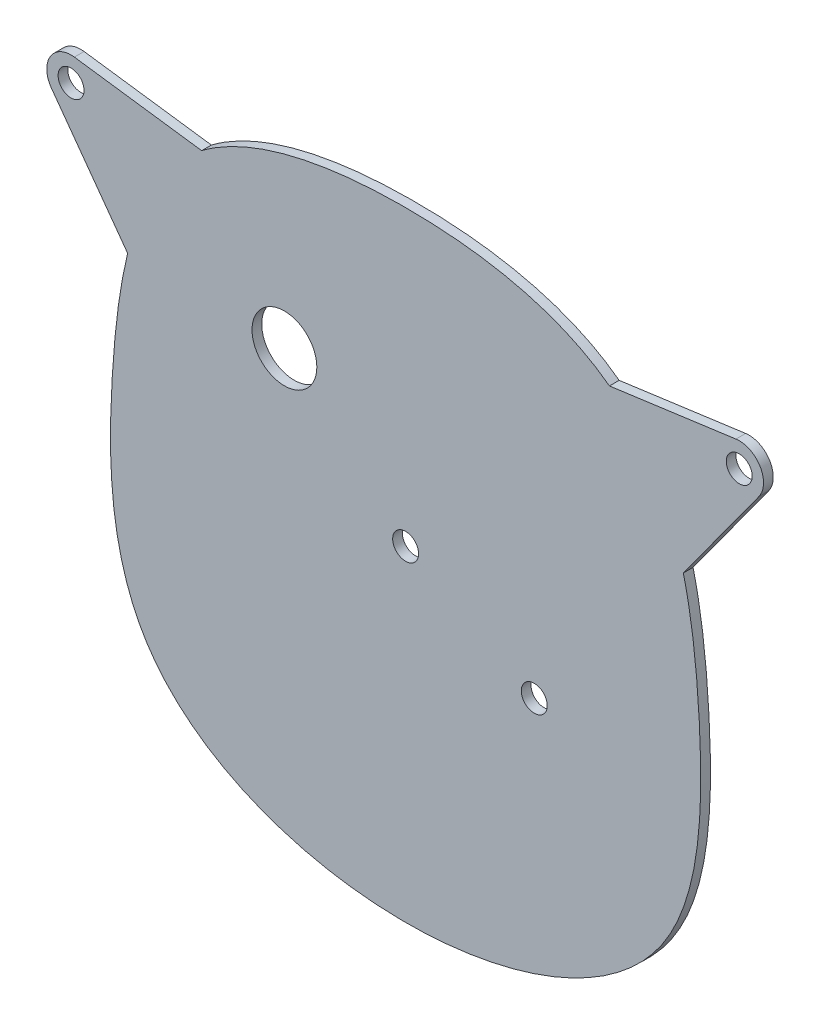
from build123d import *

# Parameters (mm, degrees)
SKETCH_2_R      = 4
SKETCH_2_R_2    = 4.000000012
SKETCH_2_R_3    = 10
EXTRUDE_2_DEPTH = 3


with BuildPart() as part:
    # 草图2 → 凸台-拉伸2 (new body)
    with BuildSketch(Plane.XY):
        with BuildLine():
            Line((-62.921735182, 74.245798648), (-102.190957478, 79.606919068))
            ThreePointArc((-102.190957478, 79.606919068), (-109.642306337, 76.02514292), (-109.271978796, 67.765931231))
            Line((-109.271978796, 67.765931231), (-85.74852731, 35.405842289))
            add(Edge.make_bspline(
                [(85.673591965, 35.711161483), (85.776981576, 35.292234587), (87.38306318, 28.632974431), (89.007173167, 18.400976728), (90.213980049, 5.05235491), (91.023425479, -8.300155004), (91.249087203, -24.88029803), (89.482806545, -40.668877417), (86.31440773, -52.443657906), (82.915098619, -60.73865793), (78.31847455, -68.385420626), (70.564310171, -77.478782389), (58.291973958, -86.77831017), (40.530617706, -94.699883912), (20.766532671, -99.44381146), (8e-09, -101.028094273), (-20.766532656, -99.44381146), (-40.530617691, -94.699883912), (-58.291973943, -86.77831017), (-70.564310156, -77.478782389), (-78.318474535, -68.385420626), (-82.915098604, -60.73865793), (-86.314407715, -52.443657906), (-89.48280653, -40.668877417), (-91.249087188, -24.88029803), (-91.023425464, -8.300155004), (-90.213980034, 5.05235491), (-89.007173152, 18.400976728), (-87.400005421, 28.526237122), (-85.826069563, 35.088143132), (-85.74852731, 35.405842289)],
                knots=[1.185395253, 1.185395253, 1.185395253, 1.185395253, 1.1875, 1.21875, 1.234375, 1.25, 1.28125, 1.3125, 1.328125, 1.34375, 1.359375, 1.375, 1.40625, 1.4375, 1.46875, 1.5, 1.53125, 1.5625, 1.59375, 1.625, 1.640625, 1.65625, 1.671875, 1.6875, 1.71875, 1.75, 1.765625, 1.78125, 1.8125, 1.814093804, 1.814093804, 1.814093804, 1.814093804], degree=3))
            Line((85.673591965, 35.711161483), (108.975098403, 67.765931229))
            ThreePointArc((108.975098403, 67.765931229), (109.345425949, 76.025142922), (101.894077084, 79.60691907))
            Line((101.894077084, 79.60691907), (62.876243855, 74.280118836))
            add(Edge.make_bspline(
                [(-62.921735182, 74.245798648), (-60.944982302, 75.738730542), (-53.853287332, 80.383898318), (-39.891400193, 86.051368752), (-20.449933028, 89.79255158), (-6.816644338, 90.499999998), (8e-09, 90.499999998), (6.816644353, 90.499999998), (20.449933043, 89.79255158), (39.891400208, 86.051368752), (53.834807053, 80.39139992), (60.912957084, 75.759697163), (62.876243855, 74.280118836)],
                knots=[0.893210136, 0.893210136, 0.893210136, 0.893210136, 0.90625, 0.9375, 0.96875, 1, 1, 1, 1.03125, 1.0625, 1.09375, 1.106689877, 1.106689877, 1.106689877, 1.106689877], degree=3))
        make_face()
        Circle(SKETCH_2_R, mode=Mode.SUBTRACT)
        with Locations((39.685870853, -20.749105073)):
            Circle(SKETCH_2_R_2, mode=Mode.SUBTRACT)
        with Locations((-103.20546325, 72.175850635)):
            Circle(SKETCH_2_R, mode=Mode.SUBTRACT)
        with Locations((102.908582862, 72.175850639)):
            Circle(SKETCH_2_R, mode=Mode.SUBTRACT)
        with Locations((-37.387532562, 34.175850637)):
            Circle(SKETCH_2_R_3, mode=Mode.SUBTRACT)
    extrude(amount=EXTRUDE_2_DEPTH)


solid = part.part
